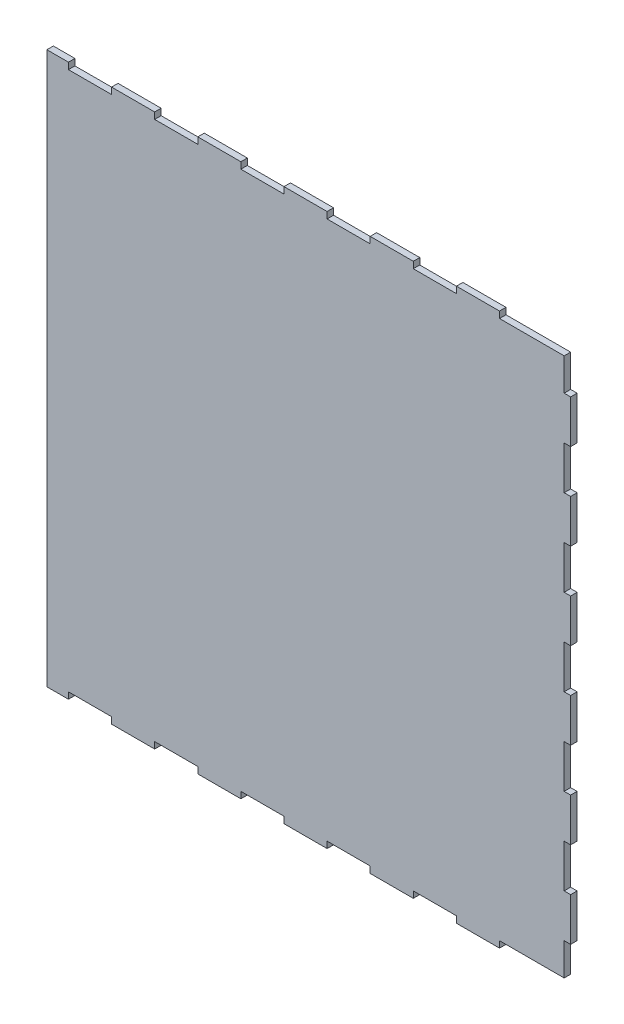
from build123d import *

# Parameters (mm, degrees)
BOSS_EXTRUDE1_DEPTH = 3


with BuildPart() as part:
    # Sketch2 → Boss-Extrude1 (new body)
    with BuildSketch(Plane.XY):
        Polygon((130.042422159, 250.05923357), (130.042422159, 253.05923357), (120.042422159, 253.05923357), (120.042422159, -2.94076643), (130.042422159, -2.94076643), (130.042422159, 0.05923357), (150.042422159, 0.05923357), (150.042422159, -2.94076643), (170.042422159, -2.94076643), (170.042422159, 0.05923357), (190.042422159, 0.05923357), (190.042422159, -2.94076643), (210.042422159, -2.94076643), (210.042422159, 0.05923357), (230.042422159, 0.05923357), (230.042422159, -2.94076643), (250.042422159, -2.94076643), (250.042422159, 0.05923357), (270.042422159, 0.05923357), (270.042422159, -2.94076643), (290.042422159, -2.94076643), (290.042422159, 0.05923357), (310.042422159, 0.05923357), (310.042422159, -2.94076643), (330.042422159, -2.94076643), (330.042422159, 0.05923357), (360.042422159, 0.05923357), (360.042422159, 15.05923357), (363.042422159, 15.05923357), (363.042422159, 35.05923357), (360.042422159, 35.05923357), (360.042422159, 55.05923357), (363.042422159, 55.05923357), (363.042422159, 75.05923357), (360.042422159, 75.05923357), (360.042422159, 95.05923357), (363.042422159, 95.05923357), (363.042422159, 115.05923357), (360.042422159, 115.05923357), (360.042422159, 135.05923357), (363.042422159, 135.05923357), (363.042422159, 155.05923357), (360.042422159, 155.05923357), (360.042422159, 175.05923357), (363.042422159, 175.05923357), (363.042422159, 195.05923357), (360.042422159, 195.05923357), (360.042422159, 215.05923357), (363.042422159, 215.05923357), (363.042422159, 235.05923357), (360.042422159, 235.05923357), (360.042422159, 250.05923357), (330.042422159, 250.05923357), (330.042422159, 253.05923357), (310.042422159, 253.05923357), (310.042422159, 250.05923357), (290.042422159, 250.05923357), (290.042422159, 253.05923357), (270.042422159, 253.05923357), (270.042422159, 250.05923357), (250.042422159, 250.05923357), (250.042422159, 253.05923357), (230.042422159, 253.05923357), (230.042422159, 250.05923357), (210.042422159, 250.05923357), (210.042422159, 253.05923357), (190.042422159, 253.05923357), (190.042422159, 250.05923357), (170.042422159, 250.05923357), (170.042422159, 253.05923357), (150.042422159, 253.05923357), (150.042422159, 250.05923357), align=None)
    extrude(amount=BOSS_EXTRUDE1_DEPTH)


solid = part.part
